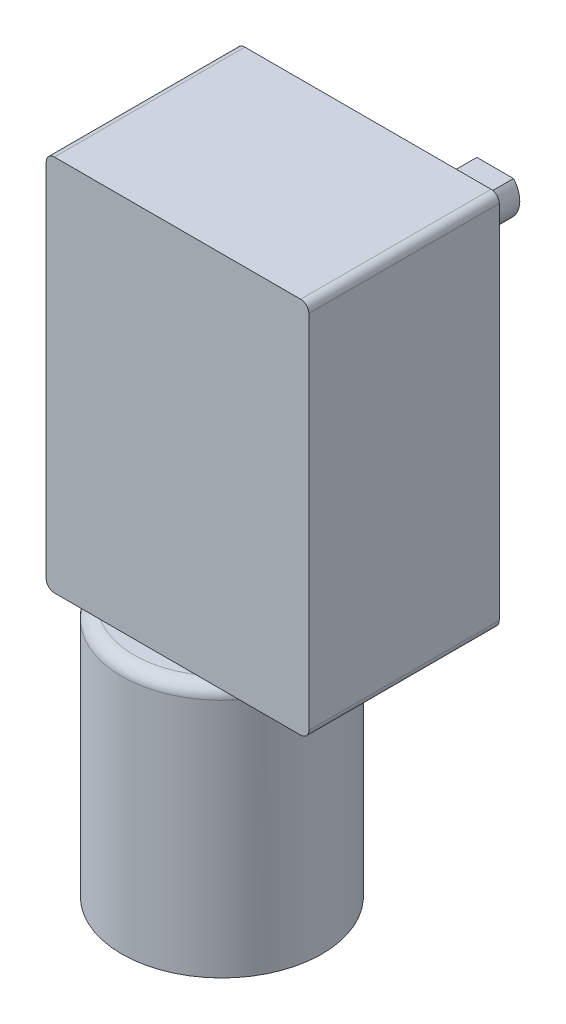
from build123d import *

# Parameters (mm, degrees)
SKETCH_1_W                   = 32
SKETCH_1_H                   = 46
EXTRUDE_1_DEPTH              = 23.2
SKETCH_1_3_R                 = 3.7
EXTRUDE_2_DEPTH              = 2
HOLE_WIZARD_M3_1_D           = 2.5
HOLE_WIZARD_M3_1_DEPTH       = 7.5
HOLE_WIZARD_M3_1_CSINK_D     = 3.05
HOLE_WIZARD_M3_1_CSINK_ANGLE = 90
HOLE_WIZARD_M3_1_TIP         = 0.751075774
SKETCH_4_R                   = 3
EXTRUDE_3_DEPTH              = 15.5
SKETCH_5_R                   = 7
EXTRUDE_4_DEPTH              = 2
HOLE_WIZARD_M3_2_D           = 2.5
HOLE_WIZARD_M3_2_DEPTH       = 14
HOLE_WIZARD_M3_2_CSINK_D     = 3.05
HOLE_WIZARD_M3_2_CSINK_ANGLE = 90
HOLE_WIZARD_M3_2_TIP         = 0.751075774
CUT_EXTRUDE_START            = -12
CUT_EXTRUDE_1_DEPTH          = 12
FILLET_1_R                   = 1
SKETCH_11_R                  = 12.2
EXTRUDE_6_DEPTH              = 30.8
FILLET_2_R                   = 1.5
SKETCH_12_R                  = 3.25
EXTRUDE_7_DEPTH              = 2


with BuildPart() as part:
    # 草图1 → 凸台-拉伸1 (new body)
    with BuildSketch(Plane.XY):
        with Locations((16, 23)):
            Rectangle(SKETCH_1_W, SKETCH_1_H)
    extrude(amount=EXTRUDE_1_DEPTH)

    # 草图1<3> → 凸台-拉伸2 (add)
    with BuildSketch(Plane.XY):
        with Locations((7, 40)):
            Circle(SKETCH_1_3_R)
        with Locations((25, 40)):
            Circle(SKETCH_1_3_R)
        with Locations((7, 7)):
            Circle(SKETCH_1_3_R)
        with Locations((25, 7)):
            Circle(SKETCH_1_3_R)
    extrude(amount=-EXTRUDE_2_DEPTH)

    # M3 螺纹孔1
    with Locations(Plane(origin=(0, 0, -2), x_dir=(-1, 0, 0), z_dir=(0, 0, -1))):
        with Locations((-7, 7), (-25, 7), (-25, 40), (-7, 40)):
            CounterSinkHole(HOLE_WIZARD_M3_1_D / 2, HOLE_WIZARD_M3_1_CSINK_D / 2, depth=HOLE_WIZARD_M3_1_DEPTH, counter_sink_angle=HOLE_WIZARD_M3_1_CSINK_ANGLE)
            with Locations((0, 0, -(HOLE_WIZARD_M3_1_DEPTH + HOLE_WIZARD_M3_1_TIP / 2))):  # 118° drill point
                Cone(0, HOLE_WIZARD_M3_1_D / 2, HOLE_WIZARD_M3_1_TIP, mode=Mode.SUBTRACT)

    # 草图4 → 凸台-拉伸3 (add)
    with BuildSketch(Plane(origin=(0, 0, 0), x_dir=(-1, 0, 0), z_dir=(0, 0, -1))):
        with Locations((-16, 31)):
            Circle(SKETCH_4_R)
    extrude(amount=EXTRUDE_3_DEPTH)

    # 草图5 → 凸台-拉伸4 (add)
    with BuildSketch(Plane(origin=(0, 0, 0), x_dir=(-1, 0, 0), z_dir=(0, 0, -1))):
        with Locations((-16, 31)):
            Circle(SKETCH_5_R)
    extrude(amount=EXTRUDE_4_DEPTH)

    # M3 螺纹孔2
    with Locations(Plane(origin=(0, 0, -15.5), x_dir=(-1, 0, 0), z_dir=(0, 0, -1))):
        with Locations((-16, 31)):
            CounterSinkHole(HOLE_WIZARD_M3_2_D / 2, HOLE_WIZARD_M3_2_CSINK_D / 2, depth=HOLE_WIZARD_M3_2_DEPTH, counter_sink_angle=HOLE_WIZARD_M3_2_CSINK_ANGLE)
            with Locations((0, 0, -(HOLE_WIZARD_M3_2_DEPTH + HOLE_WIZARD_M3_2_TIP / 2))):  # 118° drill point
                Cone(0, HOLE_WIZARD_M3_2_D / 2, HOLE_WIZARD_M3_2_TIP, mode=Mode.SUBTRACT)

    # 草图8 → 切除-拉伸1 (cut)
    with BuildSketch(Plane(origin=(0, 0, -15.5), x_dir=(-1, 0, 0), z_dir=(0, 0, -1)).offset(CUT_EXTRUDE_START)):
        with BuildLine():
            Line((-18.236067977, 33), (-13.763932023, 33))
            ThreePointArc((-13.763932023, 33), (-16, 34), (-18.236067977, 33))
        make_face()
    extrude(amount=CUT_EXTRUDE_1_DEPTH, mode=Mode.SUBTRACT)

    # 圆角1
    fillet_1_edges = [part.edges().sort_by_distance(p)[0] for p in [
        (0, 46, 11.6),
        (0, 0, 11.6),
        (32, 46, 11.6),
        (32, 0, 11.6),
    ]]
    fillet(fillet_1_edges, radius=FILLET_1_R)


with BuildPart() as body_2:
    # 草图11 → 凸台-拉伸6 (new body)
    with BuildSketch(Plane(origin=(0, -0.2, 0), x_dir=(-1, 0, 0), z_dir=(0, -1, 0))):
        with Locations((-12.2, -14)):
            Circle(SKETCH_11_R)
    extrude(amount=EXTRUDE_6_DEPTH)

    # 圆角2
    fillet_2_edges = [body_2.edges().sort_by_distance(p)[0] for p in [
        (24.4, -0.2, 14),
    ]]
    fillet(fillet_2_edges, radius=FILLET_2_R)

    # 草图12 → 凸台-拉伸7 (add)
    with BuildSketch(Plane.XZ.offset(31)):
        with Locations((12.2, 14)):
            Circle(SKETCH_12_R)
    extrude(amount=EXTRUDE_7_DEPTH)


solid = Compound([part.part, body_2.part])
